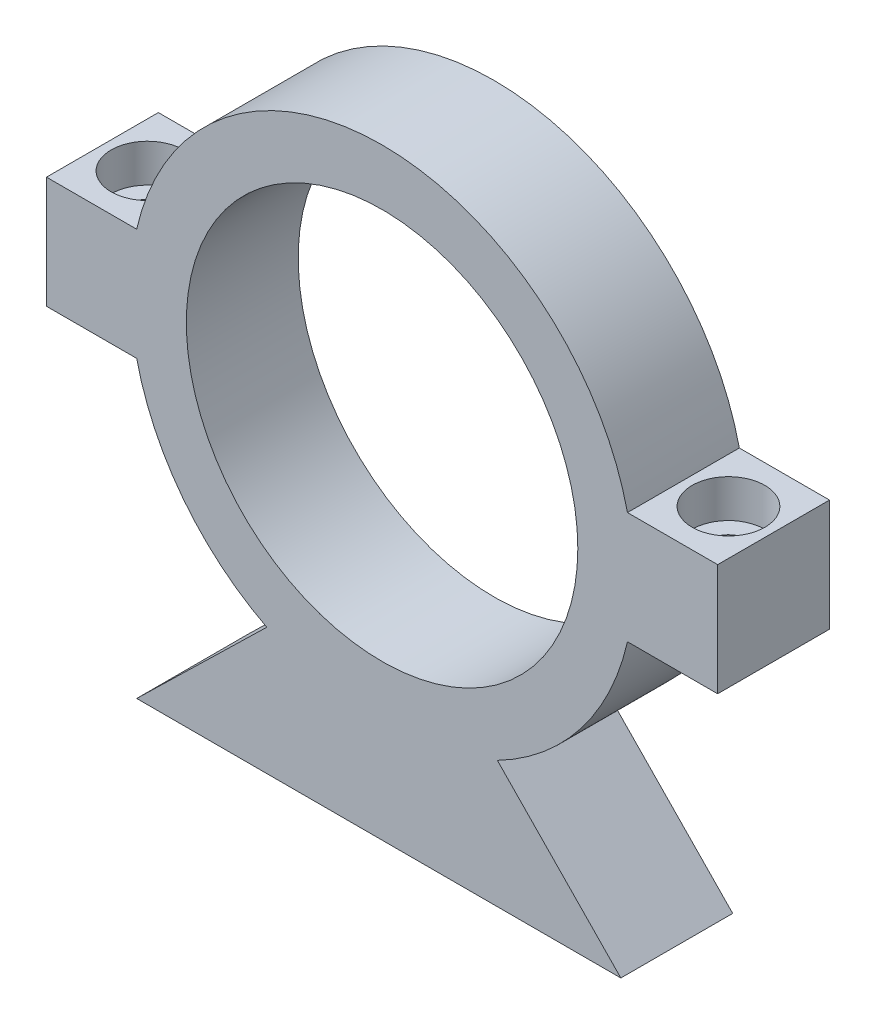
from build123d import *

# Parameters (mm, degrees)
ESQUISSE1_R                                        = 17.5
BOSS_EXTRU_1_DEPTH                                 = 10
CHAMBRAGE_POUR_VIS_T_TE_HEXAGONALE_M31_D           = 3.4
CHAMBRAGE_POUR_VIS_T_TE_HEXAGONALE_M31_CBORE_D     = 6.5
CHAMBRAGE_POUR_VIS_T_TE_HEXAGONALE_M31_CBORE_DEPTH = 3.4


with BuildPart() as part:
    # Esquisse1 → Boss.-Extru.1 (new body)
    with BuildSketch(Plane.XY):
        with BuildLine():
            Line((30, -5), (30, 5))
            Line((30, 5), (21.937410968, 5))
            ThreePointArc((21.937410968, 5), (0, 22.5), (-21.937410968, 5))
            Line((-21.937410968, 5), (-30, 5))
            Line((-30, 5), (-30, -5))
            Line((-30, -5), (-21.937410968, -5))
            ThreePointArc((-21.937410968, -5), (-17.781671131, -13.786303775), (-10.307764064, -20))
            Line((-10.307764064, -20), (-21.937410968, -31.33))
            Line((-21.937410968, -31.33), (21.345837795, -31.33))
            Line((21.345837795, -31.33), (10.307764064, -20))
            ThreePointArc((10.307764064, -20), (17.781671131, -13.786303775), (21.937410968, -5))
            Line((21.937410968, -5), (30, -5))
        make_face()
        Circle(ESQUISSE1_R, mode=Mode.SUBTRACT)
    extrude(amount=BOSS_EXTRU_1_DEPTH)

    # Chambrage pour vis à tête hexagonale M31 (through all)
    with Locations(Plane(origin=(25.97, 5, 5), x_dir=(1, 0, 0), z_dir=(0, 1, 0))):
        with Locations((0, 0)):
            chambrage_pour_vis_t_te_hexagonale_m31 = CounterBoreHole(CHAMBRAGE_POUR_VIS_T_TE_HEXAGONALE_M31_D / 2, CHAMBRAGE_POUR_VIS_T_TE_HEXAGONALE_M31_CBORE_D / 2, CHAMBRAGE_POUR_VIS_T_TE_HEXAGONALE_M31_CBORE_DEPTH)

    # Symétrie2: Chambrage pour vis à tête hexagonale M31 across plane
    add(chambrage_pour_vis_t_te_hexagonale_m31.mirror(Plane(origin=(0, 0, 0), x_dir=(0, 0, 1), z_dir=(1, 0, 0))), mode=Mode.SUBTRACT)


solid = part.part
